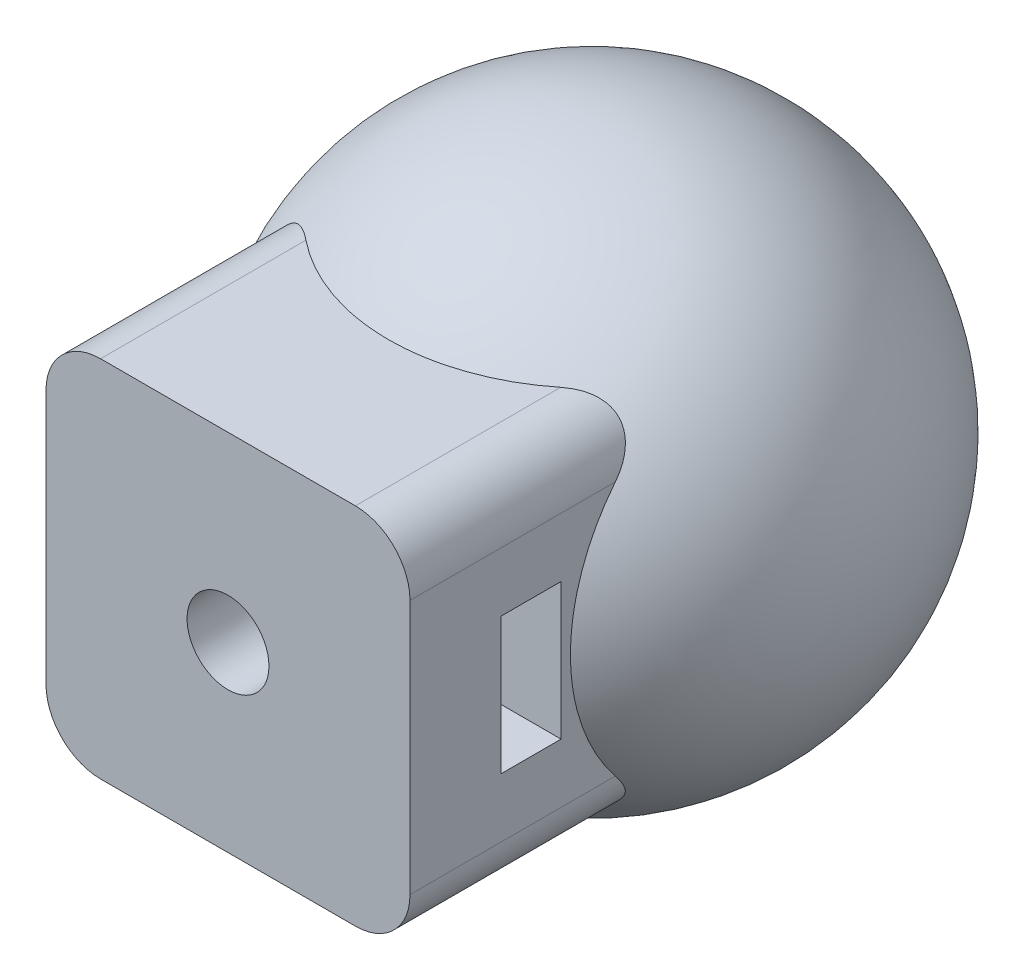
from build123d import *

# Parameters (mm, degrees)
SKETCH2_W           = 20
SKETCH2_H           = 20
BOSS_EXTRUDE1_DEPTH = 20
SKETCH3_R           = 2.25
CUT_EXTRUDE1_DEPTH  = 20
CUT_EXTRUDE2_DEPTH  = 3.3
FILLET1_R           = 3


with BuildPart() as part:
    # Sketch1 → Revolve1 (revolve)
    with BuildSketch(Plane(origin=(0, 0, 0), x_dir=(1, 0, 0), z_dir=(0, 1, 0))):
        with BuildLine():
            Line((0, 15), (0, -15))
            ThreePointArc((0, -15), (-15, 0), (0, 15))
        make_face()
    revolve(axis=Axis((0, 0, -15), (0, 0, 1)))

    # Sketch2 → Boss-Extrude1 (add)
    with BuildSketch(Plane.XY):
        Rectangle(SKETCH2_W, SKETCH2_H)
    extrude(amount=BOSS_EXTRUDE1_DEPTH)

    # Sketch3 → Cut-Extrude1 (cut)
    with BuildSketch(Plane.XY.offset(20)):
        Circle(SKETCH3_R)
    extrude(amount=-CUT_EXTRUDE1_DEPTH, mode=Mode.SUBTRACT)

    # Sketch4 → Cut-Extrude2 (cut)
    with BuildSketch(Plane.XY.offset(15)):
        Polygon((2.165063509, 3.75), (10, 3.75), (10, -3.75), (2.165063509, -3.75), (-2.165063509, -3.75), (-4.330127019, 0), (-2.165063509, 3.75), align=None)
    extrude(amount=-CUT_EXTRUDE2_DEPTH, mode=Mode.SUBTRACT)

    # Fillet1
    fillet1_edges = [part.edges().sort_by_distance(p)[0] for p in [
        (10, -10, 12.5),
        (10, 10, 12.5),
        (-10, 10, 12.5),
        (-10, -10, 12.5),
    ]]
    fillet(fillet1_edges, radius=FILLET1_R)


solid = part.part
